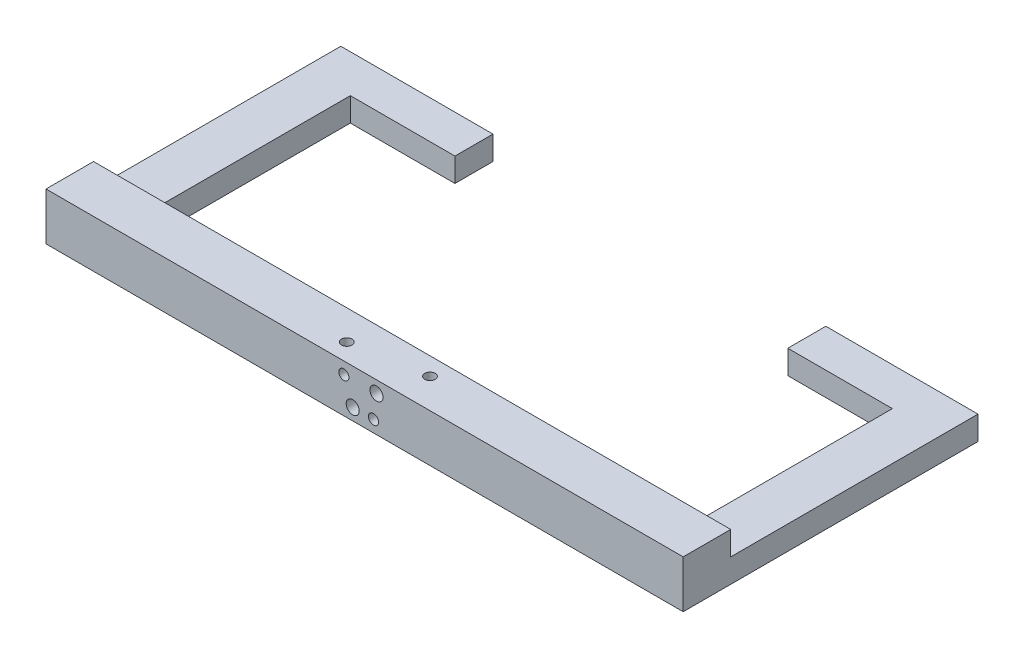
from build123d import *

# Parameters (mm, degrees)
BOSS_EXTRUDE2_DEPTH   = 6.35
BOSS_EXTRUDE2_2_DEPTH = 6.35
BOSS_EXTRUDE3_DEPTH   = 12.7
CUT_EXTRUDE2_REACH    = 189.943
SKETCH3_R             = 1.397
CUT_EXTRUDE3_REACH    = 184.986
SKETCH4_R             = 1.35255
SKETCH5_R             = 1.75
CUT_EXTRUDE5_DEPTH    = 24


with BuildPart() as part:
    # Sketch1 → Boss-Extrude2 (new body)
    with BuildSketch(Plane(origin=(0, 0, 0), x_dir=(1, 0, 0), z_dir=(0, 1, 0))):
        Polygon((12.7, 68.58), (40.64, 68.58), (40.64, 78.74), (0, 78.74), (0, 12.7), (12.7, 12.7), align=None)
    extrude(amount=BOSS_EXTRUDE2_DEPTH)



with BuildPart() as body_2:
    # Sketch1 → Boss-Extrude2 2 (new body)
    with BuildSketch(Plane(origin=(0, 0, 0), x_dir=(1, 0, 0), z_dir=(0, 1, 0))):
        Polygon((157.48, 68.58), (157.48, 12.7), (170.18, 12.7), (170.18, 78.74), (129.54, 78.74), (129.54, 68.58), align=None)
    extrude(amount=BOSS_EXTRUDE2_2_DEPTH)


with BuildPart() as part_1:
    add(part.part)

    add(body_2.part)  # Boss-Extrude3 merges body 2
    # Sketch1<3> → Boss-Extrude3 (add)
    with BuildSketch(Plane(origin=(0, 0, 0), x_dir=(1, 0, 0), z_dir=(0, 1, 0))):
        Polygon((157.48, 12.7), (12.7, 12.7), (0, 12.7), (0, 0), (170.18, 0), (170.18, 12.7), align=None)
    extrude(amount=BOSS_EXTRUDE3_DEPTH)

    # Sketch3 → Cut-Extrude2 (cut, up to next)
    with BuildSketch(Plane(origin=(0, 12.7, 0), x_dir=(1, 0, 0), z_dir=(0, 1, 0)), mode=Mode.PRIVATE) as cut_extrude2_sk1:
        with Locations((75.565, 4.7625)):
            Circle(SKETCH3_R)
    cut_extrude2_tool1 = extrude(cut_extrude2_sk1.sketch, amount=-CUT_EXTRUDE2_REACH, mode=Mode.PRIVATE) & part_1.part
    # Sketch3 → Cut-Extrude2 (cut, up to next)
    with BuildSketch(Plane(origin=(0, 12.7, 0), x_dir=(1, 0, 0), z_dir=(0, 1, 0)), mode=Mode.PRIVATE) as cut_extrude2_sk2:
        with Locations((94.615, 7.9375)):
            Circle(SKETCH3_R)
    cut_extrude2_tool2 = extrude(cut_extrude2_sk2.sketch, amount=-CUT_EXTRUDE2_REACH, mode=Mode.PRIVATE) & part_1.part
    add(cut_extrude2_tool1.solids().sort_by_distance((75.565, 12.7, -4.7625))[0], mode=Mode.SUBTRACT)
    add(cut_extrude2_tool2.solids().sort_by_distance((94.615, 12.7, -7.9375))[0], mode=Mode.SUBTRACT)

    # Sketch4 → Cut-Extrude3 (cut, up to next)
    with BuildSketch(Plane(origin=(0, 0, -12.7), x_dir=(-1, 0, 0), z_dir=(0, 0, -1)), mode=Mode.PRIVATE) as cut_extrude3_sk1:
        with Locations((-87.4776, 3.175)):
            Circle(SKETCH4_R)
    cut_extrude3_tool1 = extrude(cut_extrude3_sk1.sketch, amount=-CUT_EXTRUDE3_REACH, mode=Mode.PRIVATE) & part_1.part
    # Sketch4 → Cut-Extrude3 (cut, up to next)
    with BuildSketch(Plane(origin=(0, 0, -12.7), x_dir=(-1, 0, 0), z_dir=(0, 0, -1)), mode=Mode.PRIVATE) as cut_extrude3_sk2:
        with Locations((-79.546452542, 9.525)):
            Circle(SKETCH4_R)
    cut_extrude3_tool2 = extrude(cut_extrude3_sk2.sketch, amount=-CUT_EXTRUDE3_REACH, mode=Mode.PRIVATE) & part_1.part
    add(cut_extrude3_tool1.solids().sort_by_distance((87.4776, 3.175, -12.7))[0], mode=Mode.SUBTRACT)
    add(cut_extrude3_tool2.solids().sort_by_distance((79.546453, 9.525, -12.7))[0], mode=Mode.SUBTRACT)

    # Sketch5 → Cut-Extrude5 (cut)
    with BuildSketch(Plane(origin=(0, 0, -12.7), x_dir=(-1, 0, 0), z_dir=(0, 0, -1))):
        with Locations((-88.265, 9.525)):
            Circle(SKETCH5_R)
        with Locations((-81.915, 3.175)):
            Circle(SKETCH5_R)
    extrude(amount=-CUT_EXTRUDE5_DEPTH, mode=Mode.SUBTRACT)


solid = part_1.part
